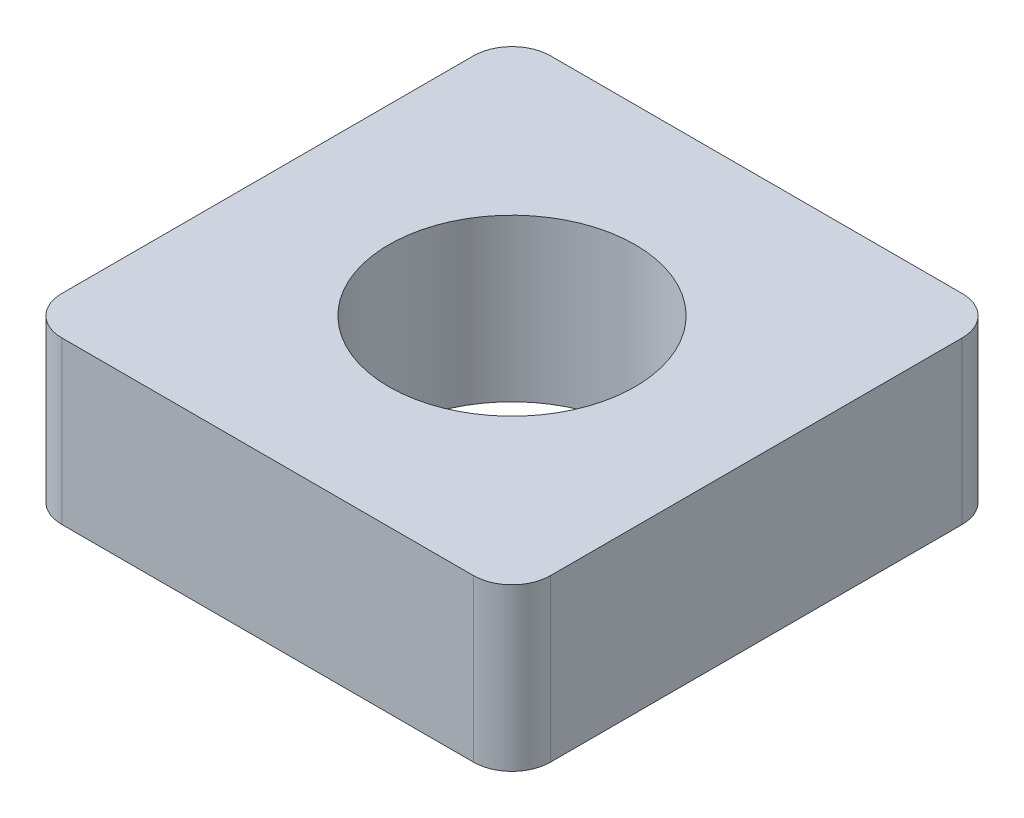
from build123d import *

# Parameters (mm, degrees)
BOSS_EXTRUDE1_DEPTH      = 1.05
BOSS_EXTRUDE1_DEPTH_BACK = 1.05
SKETCH1_R                = 1.6


with BuildPart() as part:
    # Sketch1 → Boss-Extrude1 (new, two sides: drawn at the far end of the back side and taken through both)
    with BuildSketch(Plane(origin=(0, 0, 0), x_dir=(1, 0, 0), z_dir=(0, 1, 0)).offset(-BOSS_EXTRUDE1_DEPTH_BACK)):
        with BuildLine():
            Line((-2.675, 3.175), (2.675, 3.175))
            ThreePointArc((2.675, 3.175), (3.028553391, 3.028553391), (3.175, 2.675))
            Line((3.175, 2.675), (3.175, -2.675))
            ThreePointArc((3.175, -2.675), (3.028553391, -3.028553391), (2.675, -3.175))
            Line((2.675, -3.175), (-2.675, -3.175))
            ThreePointArc((-2.675, -3.175), (-3.028553391, -3.028553391), (-3.175, -2.675))
            Line((-3.175, -2.675), (-3.175, 2.675))
            ThreePointArc((-3.175, 2.675), (-3.028553391, 3.028553391), (-2.675, 3.175))
        make_face()
        Circle(SKETCH1_R, mode=Mode.SUBTRACT)
    extrude(amount=BOSS_EXTRUDE1_DEPTH + BOSS_EXTRUDE1_DEPTH_BACK)


solid = part.part
